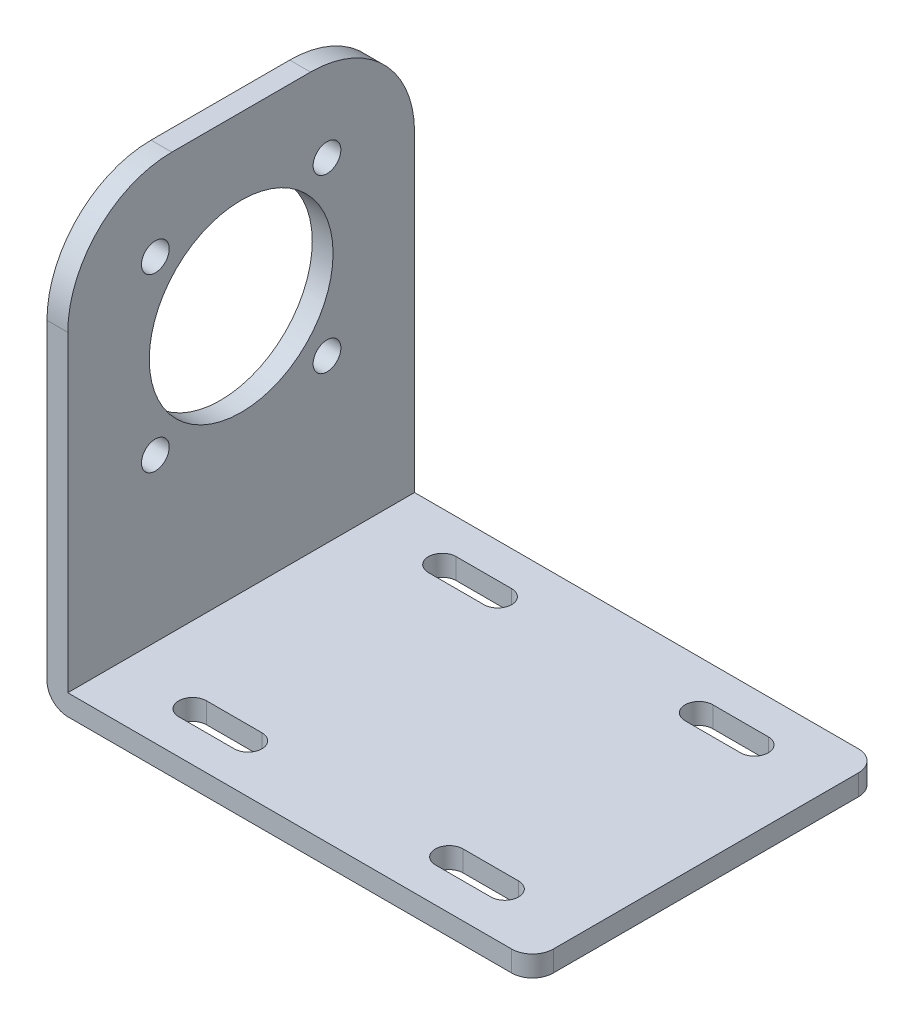
from build123d import *

# Parameters (mm, degrees)
SKETCH1_W           = 70
SKETCH1_H           = 50
BOSS_EXTRUDE1_DEPTH = 3
SKETCH2_W           = 3
SKETCH2_H           = 50
BOSS_EXTRUDE2_DEPTH = 60
SKETCH3_R           = 13.25
SKETCH3_R_2         = 2
CUT_EXTRUDE1_DEPTH  = 60
FILLET1_R           = 15
FILLET2_R           = 3


with BuildPart() as part:
    # Sketch1 → Boss-Extrude1 (new body)
    with BuildSketch(Plane(origin=(0, 0, 0), x_dir=(1, 0, 0), z_dir=(0, 1, 0))):
        with Locations((35, 25)):
            Rectangle(SKETCH1_W, SKETCH1_H)
        with BuildLine():
            Line((14, 45), (22, 45))
            ThreePointArc((22, 45), (24, 43), (22, 41))
            Line((22, 41), (14, 41))
            ThreePointArc((14, 41), (12, 43), (14, 45))
        make_face(mode=Mode.SUBTRACT)
        with BuildLine():
            Line((51, 45), (59, 45))
            ThreePointArc((59, 45), (61, 43), (59, 41))
            Line((59, 41), (51, 41))
            ThreePointArc((51, 41), (49, 43), (51, 45))
        make_face(mode=Mode.SUBTRACT)
        with BuildLine():
            Line((51, 5), (59, 5))
            ThreePointArc((59, 5), (61, 7), (59, 9))
            Line((59, 9), (51, 9))
            ThreePointArc((51, 9), (49, 7), (51, 5))
        make_face(mode=Mode.SUBTRACT)
        with BuildLine():
            Line((14, 5), (22, 5))
            ThreePointArc((22, 5), (24, 7), (22, 9))
            Line((22, 9), (14, 9))
            ThreePointArc((14, 9), (12, 7), (14, 5))
        make_face(mode=Mode.SUBTRACT)
    extrude(amount=BOSS_EXTRUDE1_DEPTH)

    # Sketch2 → Boss-Extrude2 (add)
    with BuildSketch(Plane(origin=(0, 3, 0), x_dir=(1, 0, 0), z_dir=(0, 1, 0))):
        with Locations((1.5, 25)):
            Rectangle(SKETCH2_W, SKETCH2_H)
    extrude(amount=BOSS_EXTRUDE2_DEPTH)

    # Sketch3 → Cut-Extrude1 (cut)
    with BuildSketch(Plane.ZY):
        with Locations((-25, 38.75)):
            Circle(SKETCH3_R)
        with Locations((-12.625631329, 26.375631329)):
            Circle(SKETCH3_R_2)
        with Locations((-12.625631329, 51.124368671)):
            Circle(SKETCH3_R_2)
        with Locations((-37.374368671, 51.124368671)):
            Circle(SKETCH3_R_2)
        with Locations((-37.374368671, 26.375631329)):
            Circle(SKETCH3_R_2)
    extrude(amount=-CUT_EXTRUDE1_DEPTH, mode=Mode.SUBTRACT)

    # Fillet1
    fillet1_edges = [part.edges().sort_by_distance(p)[0] for p in [
        (1.5, 63, 0),
        (1.5, 63, -50),
    ]]
    fillet(fillet1_edges, radius=FILLET1_R)

    # Fillet2
    fillet2_edges = [part.edges().sort_by_distance(p)[0] for p in [
        (0, 0, -25),
        (70, 1.5, -50),
        (70, 1.5, 0),
    ]]
    fillet(fillet2_edges, radius=FILLET2_R)


solid = part.part
